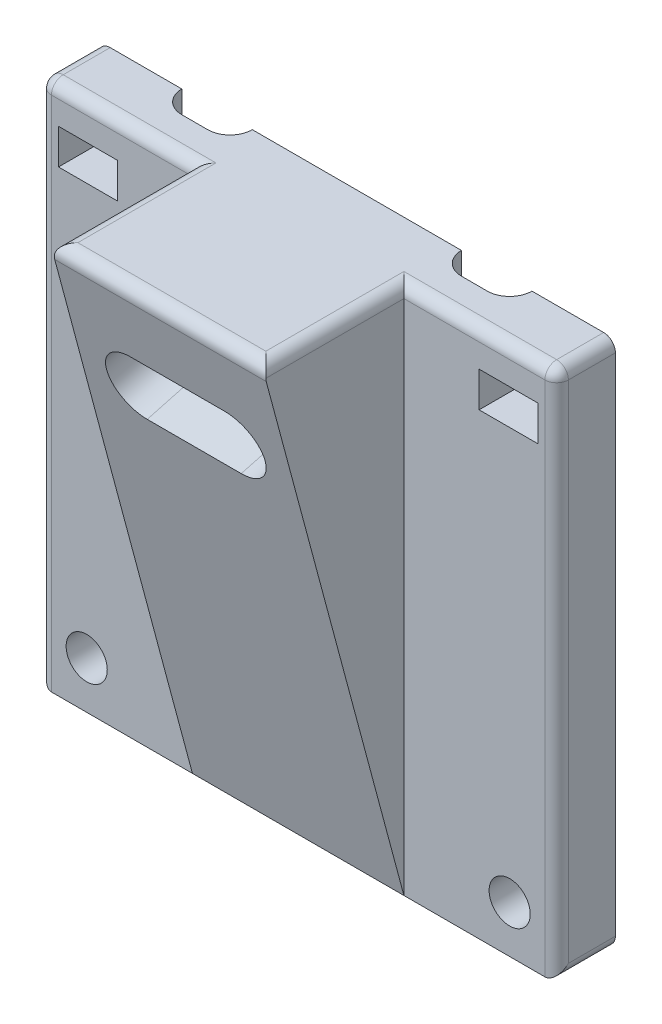
from build123d import *

# Parameters (mm, degrees)
SKETCH1_W                           = 44
SKETCH1_H                           = 45
BASE_DEPTH                          = 5
WIRE_GROOVES_DEPTH                  = 51.338851795
SLANTED_START                       = -22
SLANTED_SCREW_PLATFORM_DEPTH        = 9
MOUNTING_HOLE_SCREW_INSERTION_DEPTH = 36.040152348
SKETCH6_W                           = 5
SKETCH6_H                           = 3
ZIP_TIE_SLOTS_DEPTH                 = 34.699235283
SKETCH7_R                           = 1.75
MOUNT_CLAMPING_HOLES_DEPTH          = 34.699235283
EDGE_FILLETS_R                      = 1


with BuildPart() as part:
    # Sketch1 → Base (new body)
    with BuildSketch(Plane.XY):
        Rectangle(SKETCH1_W, SKETCH1_H)
    extrude(amount=BASE_DEPTH)

    # Sketch2 → Wire Grooves (cut, through all)
    with BuildSketch(Plane(origin=(0, 22.5, 0), x_dir=(1, 0, 0), z_dir=(0, 1, 0))):
        with BuildLine():
            Line((-14.9, 0), (-8.9, 0))
            ThreePointArc((-8.9, 0), (-9.456497116, -1.343502884), (-10.8, -1.9))
            Line((-10.8, -1.9), (-13, -1.9))
            ThreePointArc((-13, -1.9), (-14.343502884, -1.343502884), (-14.9, 0))
        make_face()
        with BuildLine():
            Line((13, -1.9), (10.8, -1.9))
            ThreePointArc((10.8, -1.9), (9.456497116, -1.343502884), (8.9, 0))
            Line((8.9, 0), (14.9, 0))
            ThreePointArc((14.9, 0), (14.343502884, -1.343502884), (13, -1.9))
        make_face()
    extrude(amount=-WIRE_GROOVES_DEPTH, mode=Mode.SUBTRACT)

    # Sketch4 → Slanted Screw Platform (add, symmetric)
    with BuildSketch(Plane(origin=(22, 0, 0), x_dir=(0, 0, -1), z_dir=(1, 0, 0)).offset(SLANTED_START)):
        Polygon((-5, -22.5), (-5, 22.5), (-17.057713659, 22.5), align=None)
    extrude(amount=SLANTED_SCREW_PLATFORM_DEPTH, both=True)

    # Sketch5 → Mounting Hole Screw Insertion (cut, through all)
    with BuildSketch(Plane(origin=(0, -2.757214207, 10.290063509), x_dir=(1, 0, 0), z_dir=(0, -0.2588190451025216, 0.9659258262890681))):
        with BuildLine():
            Line((-4, 19.25), (4, 19.25))
            ThreePointArc((4, 19.25), (6.75, 16.5), (4, 13.75))
            Line((4, 13.75), (-4, 13.75))
            ThreePointArc((-4, 13.75), (-6.75, 16.5), (-4, 19.25))
        make_face()
    extrude(amount=-MOUNTING_HOLE_SCREW_INSERTION_DEPTH, mode=Mode.SUBTRACT)

    # Sketch6 → Zip Tie Slots (cut, through all)
    with BuildSketch(Plane.XY.offset(5)):
        with Locations((-17.9, 18)):
            Rectangle(SKETCH6_W, SKETCH6_H)
        with Locations((17.9, 18)):
            Rectangle(SKETCH6_W, SKETCH6_H)
    extrude(amount=-ZIP_TIE_SLOTS_DEPTH, mode=Mode.SUBTRACT)

    # Sketch7 → Mount Clamping Holes (cut, through all)
    with BuildSketch(Plane.XY.offset(5)):
        with Locations((-18, -18.5)):
            Circle(SKETCH7_R)
        with Locations(Location((18, -18.5, 0), (0, 0, 180))):
            Circle(SKETCH7_R)
    extrude(amount=-MOUNT_CLAMPING_HOLES_DEPTH, mode=Mode.SUBTRACT)

    # Edge Fillets
    edge_fillets_edges = [part.edges().sort_by_distance(p)[0] for p in [
        (-22, 0, 5),
        (-15.5, 22.5, 5),
        (-9, 22.5, 11.02885683),
        (0, 22.5, 17.057713659),
        (22, 0, 5),
        (9, 22.5, 11.02885683),
        (22, -22.5, 2.5),
        (-22, -22.5, 2.5),
        (-22, 22.5, 2.5),
        (22, 22.5, 2.5),
        (15.5, 22.5, 5),
    ]]
    fillet(edge_fillets_edges, radius=EDGE_FILLETS_R)


solid = part.part
